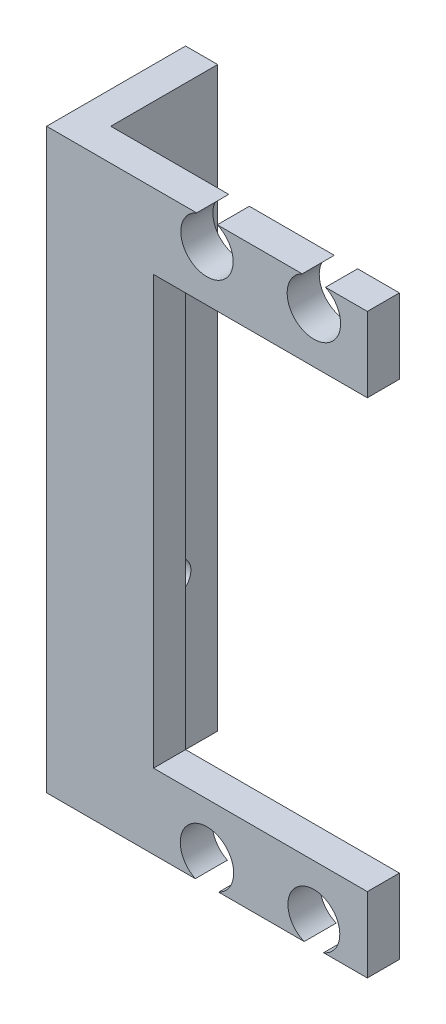
from build123d import *

# Parameters (mm, degrees)
SKETCH_1_W          = 3
SKETCH_1_H          = 54
EXTRUDE_1_DEPTH     = 13
SKETCH_3_R          = 1.5
CUT_EXTRUDE_1_DEPTH = 56.623735941
SKETCH_4_W          = 3
SKETCH_4_H          = 54
EXTRUDE_2_DEPTH     = 27
SKETCH_5_W          = 20
SKETCH_5_H          = 40
CUT_EXTRUDE_2_DEPTH = 64.126856408
SKETCH_6_R          = 2.5
SKETCH_6_R_2        = 2.424949467
SKETCH_6_R_3        = 2.447616221
CUT_EXTRUDE_3_DEPTH = 63.577951389


with BuildPart() as part:
    # 草图1 → 凸台-拉伸1 (new body)
    with BuildSketch(Plane.XY):
        with Locations((1.5, 27)):
            Rectangle(SKETCH_1_W, SKETCH_1_H)
    extrude(amount=EXTRUDE_1_DEPTH)

    # 草图3 → 切除-拉伸1 (cut, through all)
    with BuildSketch(Plane(origin=(3, 0, 0), x_dir=(0, 0, -1), z_dir=(1, 0, 0))):
        with Locations((-4, 40.5)):
            Circle(SKETCH_3_R)
        with Locations((-4, 14.3)):
            Circle(SKETCH_3_R)
    extrude(amount=-CUT_EXTRUDE_1_DEPTH, mode=Mode.SUBTRACT)

    # 草图4 → 凸台-拉伸2 (add)
    with BuildSketch(Plane(origin=(3, 0, 0), x_dir=(0, 0, -1), z_dir=(1, 0, 0))):
        with Locations((-11.5, 27)):
            Rectangle(SKETCH_4_W, SKETCH_4_H)
    extrude(amount=EXTRUDE_2_DEPTH)

    # 草图5 → 切除-拉伸2 (cut, through all)
    with BuildSketch(Plane.XY.offset(13)):
        with Locations((20, 27)):
            Rectangle(SKETCH_5_W, SKETCH_5_H)
    extrude(amount=-CUT_EXTRUDE_2_DEPTH, mode=Mode.SUBTRACT)

    # 草图6 → 切除-拉伸3 (cut, through all)
    with BuildSketch(Plane(origin=(0, 0, 10), x_dir=(-1, 0, 0), z_dir=(0, 0, -1))):
        with Locations((-25, 51.75)):
            Circle(SKETCH_6_R)
        with Locations((-25, 2.25)):
            Circle(SKETCH_6_R_2)
        with Locations((-15, 51.75)):
            Circle(SKETCH_6_R_3)
        with Locations((-15, 2.25)):
            Circle(SKETCH_6_R)
    extrude(amount=-CUT_EXTRUDE_3_DEPTH, mode=Mode.SUBTRACT)


solid = part.part
